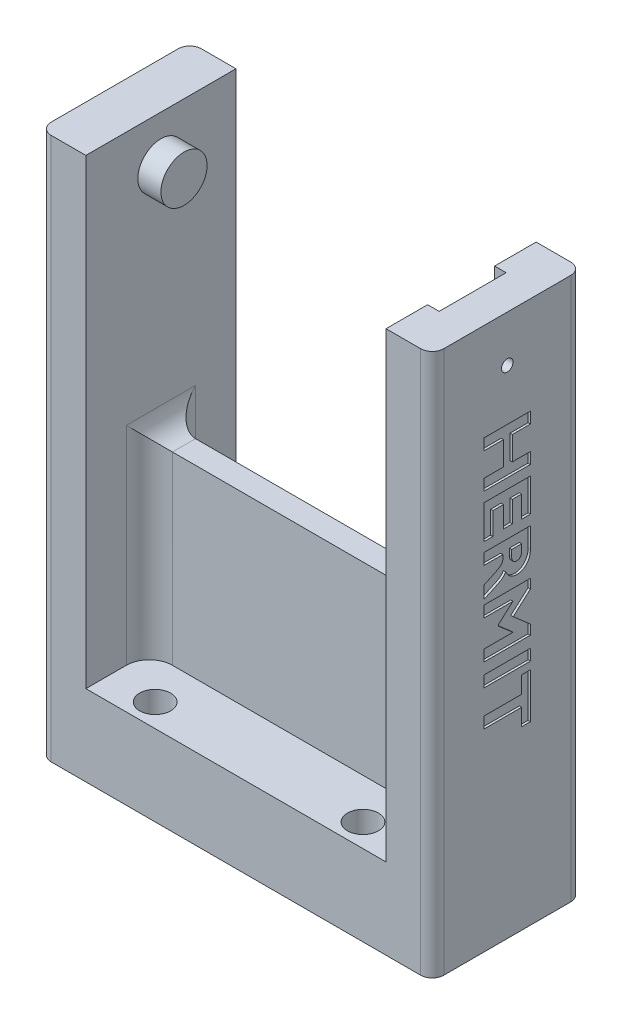
from build123d import *

# Parameters (mm, degrees)
SKETCH1_W                       = 85
SKETCH1_H                       = 32.5
BOSS_EXTRUDE1_DEPTH             = 10
SKETCH2_W                       = 85
SKETCH2_H                       = 32.5
SKETCH2_R                       = 4.125
SKETCH2_R_2                     = 2.25
BOSS_EXTRUDE2_DEPTH             = 7.5
SKETCH3_W                       = 10
SKETCH3_H                       = 32.5
BOSS_EXTRUDE3_DEPTH             = 100
SKETCH5_R                       = 5
BOSS_EXTRUDE4_DEPTH             = 5
CBORE_FOR_M3_SBHCS1_D           = 3.6
CBORE_FOR_M3_SBHCS1_CBORE_D     = 6.7
CBORE_FOR_M3_SBHCS1_CBORE_DEPTH = 9.15
CUT_EXTRUDE1_DEPTH              = 2.5
F_2_5MM_DOWEL_HOLE5_D           = 2.5
F_2_5MM_DOWEL_HOLE5_DEPTH       = 7.5
F_2_5MM_DOWEL_HOLE5_TIP         = 0.751075774
SKETCH13_W                      = 65
SKETCH13_H                      = 5
BOSS_EXTRUDE5_DEPTH             = 40
FILLET1_R                       = 2.5
FILLET2_R                       = 5
SKETCH14_W                      = 5
SKETCH14_H                      = 2.432432432
CUT_EXTRUDE4_DEPTH              = 0.5
SKETCH16_W                      = 10
SKETCH16_H                      = 2.432432432
CUT_EXTRUDE5_DEPTH              = 0.5


with BuildPart() as part:
    # Sketch1 → Boss-Extrude1 (new body)
    with BuildSketch(Plane(origin=(0, 0, 0), x_dir=(1, 0, 0), z_dir=(0, 1, 0))):
        Rectangle(SKETCH1_W, SKETCH1_H)
    extrude(amount=BOSS_EXTRUDE1_DEPTH)

    # Sketch2 → Boss-Extrude2 (add)
    # profile 1 of 3: a face of its own
    with BuildSketch(Plane.XZ):
        Rectangle(SKETCH2_W, SKETCH2_H)
        with Locations(Location((10, 0, 0), (0, 0, 270))):
            Circle(SKETCH2_R, mode=Mode.SUBTRACT)
        with Locations(Location((-10, 0, 0), (0, 0, 270))):
            Circle(SKETCH2_R, mode=Mode.SUBTRACT)
    # profile 2 of 3: a face of its own
    with BuildSketch(Plane.XZ):
        with Locations(Location((10, 0, 0), (0, 0, 270))):
            Circle(SKETCH2_R_2)
    # profile 3 of 3: a face of its own
    with BuildSketch(Plane.XZ):
        with Locations(Location((-10, 0, 0), (0, 0, 270))):
            Circle(SKETCH2_R_2)
    extrude(amount=BOSS_EXTRUDE2_DEPTH)

    # Sketch3 → Boss-Extrude3 (add)
    with BuildSketch(Plane(origin=(0, 10, 0), x_dir=(1, 0, 0), z_dir=(0, 1, 0))):
        with Locations((-37.5, 0)):
            Rectangle(SKETCH3_W, SKETCH3_H)
        with Locations((37.5, 0)):
            Rectangle(SKETCH3_W, SKETCH3_H)
    extrude(amount=BOSS_EXTRUDE3_DEPTH)

    # Sketch5 → Boss-Extrude4 (add)
    with BuildSketch(Plane(origin=(-32.5, 0, 0), x_dir=(0, 0, -1), z_dir=(1, 0, 0))):
        with Locations(Location((0, 100, 0), (0, 0, 180))):
            Circle(SKETCH5_R)
    extrude(amount=BOSS_EXTRUDE4_DEPTH)

    # CBORE for M3 SBHCS1 (through all)
    with Locations(Plane(origin=(0, 10, 0), x_dir=(1, 0, 0), z_dir=(0, 1, 0))):
        with Locations((-22.5, 11.25), (22.5, 11.25), (22.5, -11.25), (-22.5, -11.25)):
            CounterBoreHole(CBORE_FOR_M3_SBHCS1_D / 2, CBORE_FOR_M3_SBHCS1_CBORE_D / 2, CBORE_FOR_M3_SBHCS1_CBORE_DEPTH)

    # Sketch7 → Cut-Extrude1 (cut)
    with BuildSketch(Plane(origin=(32.5, 0, 0), x_dir=(0, 0, -1), z_dir=(1, 0, 0))):
        with BuildLine():
            Line((-7.25, 100), (-5.25, 69))
            ThreePointArc((-5.25, 69), (0, 63.75), (5.25, 69))
            Line((5.25, 69), (7.25, 100))
            Line((7.25, 100), (7.25, 110))
            Line((7.25, 110), (-7.25, 110))
            Line((-7.25, 110), (-7.25, 100))
        make_face()
    extrude(amount=CUT_EXTRUDE1_DEPTH, mode=Mode.SUBTRACT)

    # Ø2.5mm Dowel Hole5
    with Locations(Plane(origin=(42.5, 0, 0), x_dir=(0, 0, -1), z_dir=(1, 0, 0))):
        with Locations((0, 100), (0, 120.3)):
            Hole(F_2_5MM_DOWEL_HOLE5_D / 2, depth=F_2_5MM_DOWEL_HOLE5_DEPTH)
            with Locations((0, 0, -(F_2_5MM_DOWEL_HOLE5_DEPTH + F_2_5MM_DOWEL_HOLE5_TIP / 2))):  # 118° drill point
                Cone(0, F_2_5MM_DOWEL_HOLE5_D / 2, F_2_5MM_DOWEL_HOLE5_TIP, mode=Mode.SUBTRACT)

    # Sketch13 → Boss-Extrude5 (add)
    with BuildSketch(Plane(origin=(0, 10, 0), x_dir=(1, 0, 0), z_dir=(0, 1, 0))):
        Rectangle(SKETCH13_W, SKETCH13_H)
    extrude(amount=BOSS_EXTRUDE5_DEPTH)

    # Fillet1
    fillet1_edges = [part.edges().sort_by_distance(p)[0] for p in [
        (42.5, 51.25, 16.25),
        (-42.5, 51.25, 16.25),
        (-42.5, 51.25, -16.25),
        (42.5, 51.25, -16.25),
    ]]
    fillet(fillet1_edges, radius=FILLET1_R)

    # Fillet2
    fillet2_edges = [part.edges().sort_by_distance(p)[0] for p in [
        (32.5, 30, 2.5),
        (32.5, 30, -2.5),
        (-32.5, 30, -2.5),
        (-32.5, 30, 2.5),
        (32.5, 50, 0),
        (-32.5, 50, 0),
    ]]
    fillet(fillet2_edges, radius=FILLET2_R)

    # Sketch14 → Cut-Extrude4 (cut)
    # profile 1 of 14: a face of its own
    with BuildSketch(Plane.ZY.offset(42.5)):
        with Locations((2.5, 84.72972973)):
            Rectangle(SKETCH14_W, SKETCH14_H)
    # profile 2 of 14: a face of its own
    with BuildSketch(Plane.ZY.offset(42.5)):
        Polygon((-3.108108108, 83.513513514), (0, 83.513513514), (0, 85.945945946), (-3.108108108, 85.945945946), (-3.108108108, 89.594594595), (-5, 89.594594595), (-5, 79.864864865), (-3.108108108, 79.864864865), align=None)
    # profile 3 of 14: a face of its own
    with BuildSketch(Plane.ZY.offset(42.5)):
        with Locations((2.5, 77.027027027)):
            Rectangle(SKETCH14_W, SKETCH14_H)
    # profile 4 of 14: a face of its own
    with BuildSketch(Plane.ZY.offset(42.5)):
        with Locations((-2.5, 77.027027027)):
            Rectangle(SKETCH14_W, SKETCH14_H)
    # profile 5 of 14: a face of its own
    with BuildSketch(Plane.ZY.offset(42.5)):
        with Locations((2.5, 72.162162162)):
            Rectangle(SKETCH14_W, SKETCH14_H)
    # profile 6 of 14: a face of its own
    with BuildSketch(Plane.ZY.offset(42.5)):
        Polygon((-5, 62.702702703), (0, 62.702702703), (0, 65.135135135), (-1.228885135, 65.135135135), (0, 66.221842085), (0, 69.878362378), (-1.228885135, 70.945945946), (0, 70.945945946), (0, 73.378378378), (-5, 73.378378378), (-5, 71.288006757), (-1.279560811, 68.040540541), (-5, 64.736064189), align=None)
    # profile 7 of 14: a face of its own
    with BuildSketch(Plane.ZY.offset(42.5)):
        Polygon((0, 69.878362378), (0, 66.221842085), (1.891891892, 67.894847973), (1.891891892, 68.234797297), align=None)
    # profile 8 of 14: a face of its own
    with BuildSketch(Plane.ZY.offset(42.5)):
        with Locations((2.5, 63.918918919)):
            Rectangle(SKETCH14_W, SKETCH14_H)
    # profile 9 of 14: a face of its own
    with BuildSketch(Plane.ZY.offset(42.5)):
        with BuildLine():
            Line((0, 59.417649781), (0, 52.837837838))
            Line((0, 52.837837838), (5, 52.837837838))
            Line((5, 52.837837838), (5, 55.27027027))
            Line((5, 55.27027027), (0.945945946, 55.27027027))
            Line((0.945945946, 55.27027027), (0.945945946, 56.019847973))
            add(Edge.make_bspline(
                [(5, 58.937922297), (4.899398715, 58.888569661), (4.735691734, 58.806967121), (4.496719749, 58.69518882), (4.276726996, 58.591079329), (4.028419794, 58.475328377), (3.751799279, 58.348659338), (3.447263738, 58.21176629), (3.12525076, 58.066181568), (2.803413636, 57.91957094), (2.504424433, 57.771905099), (2.234968237, 57.630561942), (1.996225664, 57.494285485), (1.789092182, 57.361634488), (1.612940006, 57.234668429), (1.465214112, 57.115093366), (1.313491669, 56.9634389), (1.167085372, 56.770703316), (0.998061611, 56.453318957), (0.94636172, 56.191538094), (0.945945946, 56.019847973)],
                knots=[0, 0, 0, 0, 0.064254228, 0.104872841, 0.151269512, 0.203809795, 0.261959097, 0.325719545, 0.395258069, 0.464597225, 0.528489089, 0.586437782, 0.639047767, 0.686065133, 0.727397227, 0.763516303, 0.79490679, 0.850197544, 0.901643004, 1, 1, 1, 1], degree=3))
            Line((5, 58.937922297), (5, 61.621621622))
            add(Edge.make_bspline(
                [(0.337837838, 58.819679054), (0.401094968, 58.963493119), (0.530550298, 59.174045973), (0.762436217, 59.422800626), (0.974385075, 59.61485022), (1.226343238, 59.796038145), (1.509381382, 59.979529976), (1.831283197, 60.152843047), (2.303956175, 60.376994077), (2.910459415, 60.648520234), (3.851894754, 61.081102344), (4.545074367, 61.407405568), (5, 61.621621622)],
                knots=[0, 0, 0, 0, 0.085159229, 0.132712899, 0.184067275, 0.240028434, 0.300806138, 0.366913241, 0.438105731, 0.584497931, 0.727289612, 1, 1, 1, 1], degree=3))
            add(Edge.make_bspline(
                [(0, 59.417649781), (0.129758646, 59.228747259), (0.24035128, 59.026477578), (0.337837838, 58.819679054)],
                knots=[0.784277252, 0.784277252, 0.784277252, 0.784277252, 1, 1, 1, 1], degree=3))
        make_face()
    # profile 10 of 14: a face of its own
    with BuildSketch(Plane.ZY.offset(42.5)):
        with BuildLine():
            Line((-5, 52.837837838), (0, 52.837837838))
            Line((0, 52.837837838), (0, 59.417649781))
            add(Edge.make_bspline(
                [(-2.115709459, 60.540540541), (-1.85480331, 60.539377189), (-1.466570405, 60.493089254), (-0.990190808, 60.306399998), (-0.66574813, 60.116548336), (-0.368776821, 59.872065428), (-0.15262371, 59.629873753), (-0.036449656, 59.470713158), (0, 59.417649781)],
                knots=[0, 0, 0, 0, 0.246231146, 0.362921628, 0.479674218, 0.598833026, 0.723679981, 0.784277252, 0.784277252, 0.784277252, 0.784277252], degree=3))
            add(Edge.make_bspline(
                [(-5, 57.284628378), (-5.00177804, 57.515107817), (-4.974930898, 57.854617975), (-4.88811892, 58.291511494), (-4.794177959, 58.595205717), (-4.675780057, 58.881703535), (-4.531726328, 59.151793813), (-4.359850288, 59.404666334), (-4.161272817, 59.636367869), (-3.94828749, 59.849609572), (-3.719500831, 60.034225375), (-3.478623137, 60.188755827), (-3.228874029, 60.319762779), (-2.965702933, 60.418986789), (-2.596345876, 60.512681975), (-2.309043255, 60.540067523), (-2.115709459, 60.540540541)],
                knots=[0, 0, 0, 0, 0.142177861, 0.209577866, 0.274582683, 0.338083276, 0.400673634, 0.463217227, 0.526413874, 0.588780651, 0.649035292, 0.707484992, 0.765198547, 0.822813893, 0.88066629, 1, 1, 1, 1], degree=3))
            Line((-5, 57.284628378), (-5, 52.837837838))
        make_face()
        with BuildLine():
            Line((-0.945945946, 55.27027027), (-3.108108108, 55.27027027))
            Line((-3.108108108, 55.27027027), (-3.108108108, 56.539273649))
            add(Edge.make_bspline(
                [(-2.033361486, 57.972972973), (-2.19193233, 57.969792439), (-2.43112178, 57.939980959), (-2.695132343, 57.778856035), (-2.850025049, 57.616252044), (-2.967394661, 57.407582531), (-3.085775279, 57.049889415), (-3.107160707, 56.749151859), (-3.108108108, 56.539273649)],
                knots=[0, 0, 0, 0, 0.235917891, 0.341314643, 0.448877705, 0.562447782, 0.69037411, 1, 1, 1, 1], degree=3))
            add(Edge.make_bspline(
                [(-0.945945946, 56.596283784), (-0.945902476, 56.786859499), (-0.9713027, 57.064532645), (-1.09547253, 57.398193579), (-1.219793414, 57.602919628), (-1.377341686, 57.769944336), (-1.640299683, 57.934030103), (-1.875924953, 57.973984779), (-2.033361486, 57.972972973)],
                knots=[0, 0, 0, 0, 0.289522178, 0.416004754, 0.536093645, 0.649908755, 0.760504894, 1, 1, 1, 1], degree=3))
            Line((-0.945945946, 56.596283784), (-0.945945946, 55.27027027))
        make_face(mode=Mode.SUBTRACT)
    # profile 11 of 14: a face of its own
    with BuildSketch(Plane.ZY.offset(42.5)):
        Polygon((0, 50.540540541), (0, 43.513513514), (5, 43.513513514), (5, 50.810810811), (3.108108108, 50.810810811), (3.108108108, 45.945945946), (0.810810811, 45.945945946), (0.810810811, 50.540540541), align=None)
    # profile 12 of 14: a face of its own
    with BuildSketch(Plane.ZY.offset(42.5)):
        Polygon((-5, 43.513513514), (0, 43.513513514), (0, 50.540540541), (-1.081081081, 50.540540541), (-1.081081081, 45.945945946), (-3.108108108, 45.945945946), (-3.108108108, 50.675675676), (-5, 50.675675676), align=None)
    # profile 13 of 14: a face of its own
    with BuildSketch(Plane.ZY.offset(42.5)):
        Polygon((0, 41.351351351), (0, 31.351351351), (5, 31.351351351), (5, 33.783783784), (0.810810811, 33.783783784), (0.810810811, 38.918918919), (5, 38.918918919), (5, 41.351351351), align=None)
    # profile 14 of 14: a face of its own
    with BuildSketch(Plane.ZY.offset(42.5)):
        Polygon((-5, 31.351351351), (0, 31.351351351), (0, 41.351351351), (-5, 41.351351351), (-5, 38.918918919), (-1.081081081, 38.918918919), (-1.081081081, 33.783783784), (-5, 33.783783784), align=None)
    extrude(amount=-CUT_EXTRUDE4_DEPTH, mode=Mode.SUBTRACT)

    # Sketch16 → Cut-Extrude5 (cut)
    # profile 1 of 6: a face of its own
    with BuildSketch(Plane(origin=(42.5, 0, 0), x_dir=(0, 0, -1), z_dir=(1, 0, 0))):
        Polygon((5, 78.918918919), (-5, 78.918918919), (-5, 81.351351351), (-0.810810811, 81.351351351), (-0.810810811, 86.486486486), (-5, 86.486486486), (-5, 88.918918919), (5, 88.918918919), (5, 86.486486486), (1.081081081, 86.486486486), (1.081081081, 81.351351351), (5, 81.351351351), align=None)
    # profile 2 of 6: a face of its own
    with BuildSketch(Plane(origin=(42.5, 0, 0), x_dir=(0, 0, -1), z_dir=(1, 0, 0))):
        Polygon((-3.108108108, 69.459459459), (-5, 69.459459459), (-5, 76.756756757), (5, 76.756756757), (5, 69.594594595), (3.108108108, 69.594594595), (3.108108108, 74.324324324), (1.081081081, 74.324324324), (1.081081081, 69.72972973), (-0.810810811, 69.72972973), (-0.810810811, 74.324324324), (-3.108108108, 74.324324324), align=None)
    # profile 3 of 6: a face of its own
    with BuildSketch(Plane(origin=(42.5, 0, 0), x_dir=(0, 0, -1), z_dir=(1, 0, 0))):
        with BuildLine():
            Line((5, 67.432432432), (5, 62.985641892))
            add(Edge.make_bspline(
                [(5, 62.985641892), (5.001780816, 62.755160635), (4.974925661, 62.415655725), (4.888126232, 61.978753988), (4.794151845, 61.675081652), (4.675874586, 61.388504841), (4.531103478, 61.118189507), (4.360476672, 60.863796647), (4.161872021, 60.631876077), (3.947692702, 60.420492086), (3.71882642, 60.236460113), (3.479875224, 60.078625578), (3.228180904, 59.951125623), (2.96580792, 59.851087462), (2.596273406, 59.757723604), (2.309080801, 59.730132646), (2.115709459, 59.72972973)],
                knots=[0, 0, 0, 0, 0.142164586, 0.209558297, 0.274557045, 0.338051709, 0.400636223, 0.463533586, 0.526724332, 0.588780378, 0.649029393, 0.707710511, 0.76522047, 0.822830437, 0.880677433, 1, 1, 1, 1], degree=3))
            add(Edge.make_bspline(
                [(2.115709459, 59.72972973), (1.85480331, 59.730893081), (1.466570405, 59.777181016), (0.990190808, 59.963870273), (0.66574813, 60.153721934), (0.368776821, 60.398204842), (-0.000457966, 60.81191895), (-0.212966966, 61.185702267), (-0.337837838, 61.450591216)],
                knots=[0, 0, 0, 0, 0.246231146, 0.362921628, 0.479674218, 0.598833026, 0.723679981, 1, 1, 1, 1], degree=3))
            add(Edge.make_bspline(
                [(-0.337837838, 61.450591216), (-0.401091489, 61.306771518), (-0.530557995, 61.09623676), (-0.762422822, 60.847447953), (-0.974441719, 60.655511773), (-1.22658418, 60.473495071), (-1.510889057, 60.292098133), (-1.832005323, 60.116128501), (-2.306005908, 59.894560083), (-2.911319434, 59.621296097), (-3.853859648, 59.192573626), (-4.543816038, 58.860879433), (-5, 58.648648649)],
                knots=[0, 0, 0, 0, 0.085160366, 0.13271467, 0.184069732, 0.240031637, 0.30113175, 0.366904965, 0.438442438, 0.584836592, 0.727124173, 1, 1, 1, 1], degree=3))
            Line((-5, 58.648648649), (-5, 61.332347973))
            add(Edge.make_bspline(
                [(-5, 61.332347973), (-4.899387031, 61.3816753), (-4.735721959, 61.463368619), (-4.496657993, 61.574947682), (-4.277275397, 61.679674779), (-4.028284809, 61.791715684), (-3.753565818, 61.920279116), (-3.449366423, 62.056373022), (-3.126829718, 62.201531544), (-2.806000046, 62.351031817), (-2.506104643, 62.498868082), (-2.235377843, 62.639152483), (-1.996255952, 62.776041041), (-1.789084238, 62.908622701), (-1.612945488, 63.035606519), (-1.465201507, 63.155170359), (-1.31354375, 63.306856853), (-1.166349753, 63.499893702), (-0.999539044, 63.81832296), (-0.945346556, 64.079032949), (-0.945945946, 64.250422297)],
                knots=[0, 0, 0, 0, 0.064256604, 0.104876719, 0.151275106, 0.203648109, 0.261432875, 0.325195681, 0.394736777, 0.464248589, 0.528142816, 0.586450913, 0.639062844, 0.686081949, 0.727415572, 0.763535983, 0.794927632, 0.85022043, 0.902025886, 1, 1, 1, 1], degree=3))
            Line((-0.945945946, 64.250422297), (-0.945945946, 65))
            Line((-0.945945946, 65), (-5, 65))
            Line((-5, 65), (-5, 67.432432432))
            Line((-5, 67.432432432), (5, 67.432432432))
        make_face()
        with BuildLine():
            Line((3.108108108, 65), (0.945945946, 65))
            Line((0.945945946, 65), (0.945945946, 63.673986486))
            add(Edge.make_bspline(
                [(0.945945946, 63.673986486), (0.946155307, 63.483558368), (0.970861626, 63.205480138), (1.095904814, 62.872749199), (1.217441001, 62.666833826), (1.375598282, 62.499666726), (1.640226002, 62.33732381), (1.875627851, 62.29574163), (2.033361486, 62.297297297)],
                knots=[0, 0, 0, 0, 0.289420706, 0.415858953, 0.535351373, 0.649126593, 0.760588832, 1, 1, 1, 1], degree=3))
            add(Edge.make_bspline(
                [(2.033361486, 62.297297297), (2.19193233, 62.300477831), (2.43112178, 62.330289311), (2.695132343, 62.491414235), (2.850025049, 62.654018226), (2.967394661, 62.862687739), (3.085775279, 63.220380856), (3.107160707, 63.521118411), (3.108108108, 63.730996622)],
                knots=[0, 0, 0, 0, 0.235917891, 0.341314643, 0.448877705, 0.562447782, 0.69037411, 1, 1, 1, 1], degree=3))
            Line((3.108108108, 63.730996622), (3.108108108, 65))
        make_face(mode=Mode.SUBTRACT)
    # profile 4 of 6: a face of its own
    with BuildSketch(Plane(origin=(42.5, 0, 0), x_dir=(0, 0, -1), z_dir=(1, 0, 0))):
        Polygon((1.279560811, 52.22972973), (5, 48.982263514), (5, 46.891891892), (-5, 46.891891892), (-5, 49.324324324), (1.228885135, 49.324324324), (-1.891891892, 52.035472973), (-1.891891892, 52.375422297), (1.228885135, 55.135135135), (-5, 55.135135135), (-5, 57.567567568), (5, 57.567567568), (5, 55.534206081), align=None)
    # profile 5 of 6: a face of its own
    with BuildSketch(Plane(origin=(42.5, 0, 0), x_dir=(0, 0, -1), z_dir=(1, 0, 0))):
        with Locations((0, 43.243243243)):
            Rectangle(SKETCH16_W, SKETCH16_H)
    # profile 6 of 6: a face of its own
    with BuildSketch(Plane(origin=(42.5, 0, 0), x_dir=(0, 0, -1), z_dir=(1, 0, 0))):
        Polygon((5, 30.675675676), (3.108108108, 30.675675676), (3.108108108, 34.324324324), (-5, 34.324324324), (-5, 36.756756757), (3.108108108, 36.756756757), (3.108108108, 40.405405405), (5, 40.405405405), align=None)
    extrude(amount=-CUT_EXTRUDE5_DEPTH, mode=Mode.SUBTRACT)


solid = part.part
